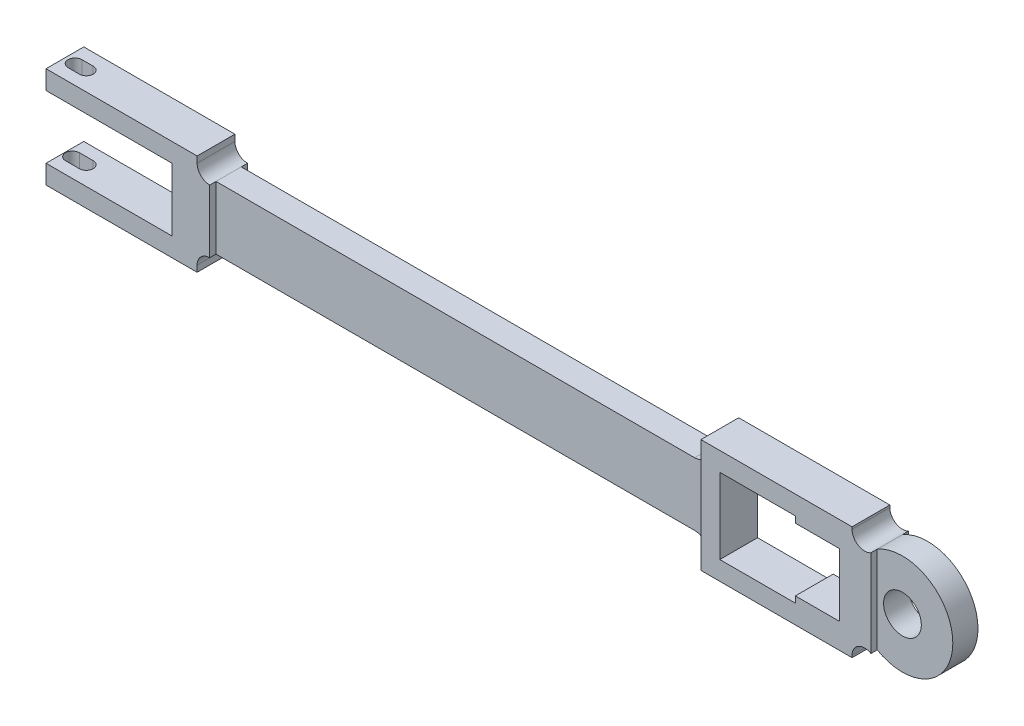
from build123d import *
from build123d.topology import SkipClean

# Parameters (mm, degrees)
BOSS_EXTRU_3_DEPTH           = 3
ENL_V_MAT_EXTRU_1_DEPTH      = 63.157059132
ENL_V_MAT_EXTRU_1_DEPTH_BACK = 3
ENL_V_MAT_EXTRU_2_DEPTH      = 3
ESQUISSE5_W                  = 6
ESQUISSE5_H                  = 0.5
ENL_V_MAT_EXTRU_4_DEPTH      = 63.227405538


with BuildPart() as part:
    # Esquisse1 → Boss.-Extru.3 (new body)
    with BuildSketch(Plane.XY):
        with BuildLine():
            Line((43.5, 0), (0, 0))
            Line((0, 0), (0, -2.5))
            Line((0, -2.5), (-10, -2.5))
            Line((-10, -2.5), (-10, -4))
            Line((-10, -4), (2, -4))
            Line((2, -4), (2, -3.5))
            ThreePointArc((2, -3.5), (2.292893219, -2.792893219), (3, -2.5))
            Line((3, -2.5), (41, -2.5))
            ThreePointArc((41, -2.5), (41.707106781, -2.792893219), (42, -3.5))
            Line((42, -3.5), (42, -4.5))
            Line((42, -4.5), (54, -4.5))
            Line((54, -4.5), (54, -4.330127019))
            ThreePointArc((54, -4.330127019), (54.5, -3.464101615), (55.5, -3.464101615))
            ThreePointArc((55.5, -3.464101615), (59.5, -3.464101615), (61.5, 0))
            Line((61.5, 0), (59, 0))
            ThreePointArc((59, 0), (57.5, -1.5), (56, 0))
            Line((56, 0), (53, 0))
            Line((53, 0), (53, -2.5))
            Line((53, -2.5), (49.5, -2.5))
            Line((49.5, -2.5), (49.5, -3))
            Line((49.5, -3), (43.5, -3))
            Line((43.5, -3), (43.5, 0))
        make_face()
    boss_extru_3 = extrude(amount=BOSS_EXTRU_3_DEPTH)

    # Symétrie2: Boss.-Extru.3 across plane
    with SkipClean():  # the faces are left unmerged after this step: merging them gives an invalid solid
        add(boss_extru_3.mirror(Plane(origin=(0, 0, 3), x_dir=(0, 0, 1), z_dir=(0, 1, 0))))

    # Esquisse2 → Enlèv. mat.-Extru.1 (cut, two sides: drawn at the far end of the back side and taken through both)
    with SkipClean():  # the faces are left unmerged after this step: merging them gives an invalid solid
        with BuildSketch(Plane(origin=(0, 4, 0), x_dir=(1, 0, 0), z_dir=(0, 1, 0)).offset(-ENL_V_MAT_EXTRU_1_DEPTH_BACK)):
            with BuildLine():
                Line((-9.2, -0.95), (-8.3, -0.95))
                ThreePointArc((-8.3, -0.95), (-7.75, -1.5), (-8.3, -2.05))
                Line((-8.3, -2.05), (-9.2, -2.05))
                ThreePointArc((-9.2, -2.05), (-9.75, -1.5), (-9.2, -0.95))
            make_face()
        extrude(amount=ENL_V_MAT_EXTRU_1_DEPTH + ENL_V_MAT_EXTRU_1_DEPTH_BACK, mode=Mode.SUBTRACT)

    # Esquisse3 → Enlèv. mat.-Extru.2 (cut)
    with SkipClean():  # the faces are left unmerged after this step: merging them gives an invalid solid
        with BuildSketch(Plane.XZ.offset(4)):
            with BuildLine():
                Line((-9.4, 2.05), (-8.3, 2.05))
                ThreePointArc((-8.3, 2.05), (-7.75, 1.5), (-8.3, 0.95))
                Line((-8.3, 0.95), (-9.4, 0.95))
                ThreePointArc((-9.4, 0.95), (-9.95, 1.5), (-9.4, 2.05))
            make_face()
        extrude(amount=-ENL_V_MAT_EXTRU_2_DEPTH, mode=Mode.SUBTRACT)

    # Esquisse5 → Enlèv. mat.-Extru.4 (cut, through all)
    with SkipClean():  # the faces are left unmerged after this step: merging them gives an invalid solid
        with BuildSketch(Plane.XZ.offset(4.5)):
            Polygon((42, 2.5), (42, 3), (3, 3), (3, 2.5), (41, 2.5), align=None)
            Polygon((3, 0), (42, 0), (42, 0.5), (41, 0.5), (3, 0.5), align=None)
            with Locations((58.5, 2.75)):
                Rectangle(ESQUISSE5_W, ESQUISSE5_H)
            with Locations((58.5, 0.25)):
                Rectangle(ESQUISSE5_W, ESQUISSE5_H)
        extrude(amount=-ENL_V_MAT_EXTRU_4_DEPTH, mode=Mode.SUBTRACT)


solid = part.part
